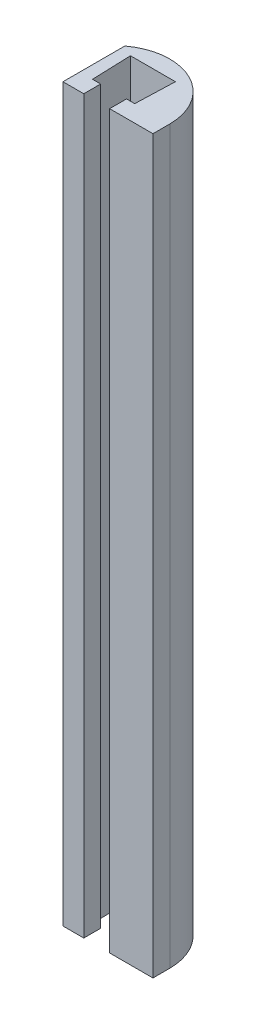
from build123d import *

# Parameters (mm, degrees)
AUFSATZ_LINEAR_AUSTRAGEN1_DEPTH = 130
SKIZZE2_R                       = 3.75
SCHNITT_LINEAR_AUSTRAGEN1_DEPTH = 131.766968306


with BuildPart() as part:
    # Skizze1 → Aufsatz-Linear austragen1 (new body)
    with BuildSketch(Plane(origin=(0, 0, 0), x_dir=(1, 0, 0), z_dir=(0, 1, 0))):
        with BuildLine():
            Line((2.3, 0), (10, 0))
            Line((10, 0), (10, 3))
            ThreePointArc((10, 3), (7.071067812, 10.071067812), (0, 13))
            ThreePointArc((0, 13), (-3.16227766, 12.486832981), (-6, 11))
            Line((-6, 11), (-6, 0))
            Line((-6, 0), (-2.3, 0))
            Line((-2.3, 0), (-2.3, 3))
            Line((-2.3, 3), (-3.75, 3))
            Line((-3.75, 3), (-4, 10))
            Line((-4, 10), (4, 10))
            Line((4, 10), (3.75, 3))
            Line((3.75, 3), (2.3, 3))
            Line((2.3, 3), (2.3, 0))
        make_face()
    extrude(amount=AUFSATZ_LINEAR_AUSTRAGEN1_DEPTH)

    # Skizze2 → Schnitt-Linear austragen1 (cut, through all)
    with BuildSketch(Plane(origin=(0, 0, -3), x_dir=(-1, 0, 0), z_dir=(0, 0, -1))):
        with Locations(Location((0, 14, 0), (0, 0, 270))):
            Circle(SKIZZE2_R)
    extrude(amount=SCHNITT_LINEAR_AUSTRAGEN1_DEPTH, mode=Mode.SUBTRACT)


solid = part.part
